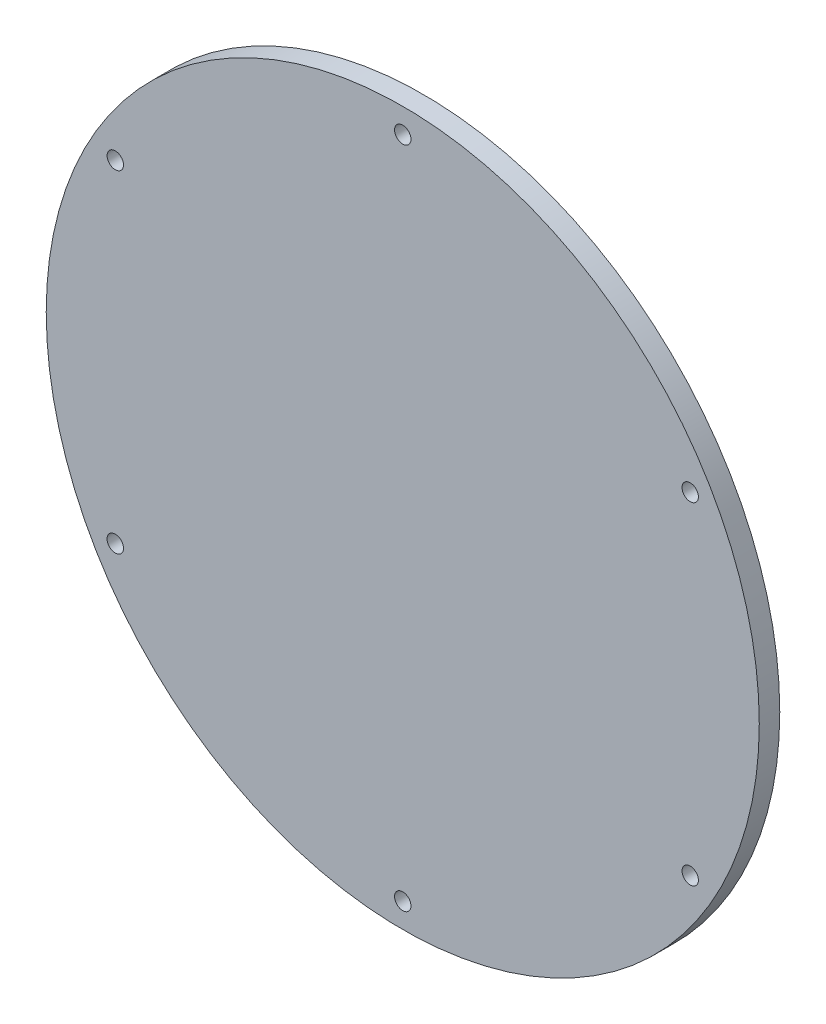
from build123d import *

# Parameters (mm, degrees)
SKETCH1_R           = 174
SKETCH1_R_2         = 4
BOSS_EXTRUDE1_DEPTH = 10


with BuildPart() as part:
    # Sketch1 → Boss-Extrude1 (new body)
    with BuildSketch(Plane.XY):
        Circle(SKETCH1_R)
        with Locations((0, 162)):
            Circle(SKETCH1_R_2, mode=Mode.SUBTRACT)
        with Locations((140.296115413, 81)):
            Circle(SKETCH1_R_2, mode=Mode.SUBTRACT)
        with Locations((140.296115413, -81)):
            Circle(SKETCH1_R_2, mode=Mode.SUBTRACT)
        with Locations((0, -162)):
            Circle(SKETCH1_R_2, mode=Mode.SUBTRACT)
        with Locations((-140.296115413, -81)):
            Circle(SKETCH1_R_2, mode=Mode.SUBTRACT)
        with Locations((-140.296115413, 81)):
            Circle(SKETCH1_R_2, mode=Mode.SUBTRACT)
    extrude(amount=BOSS_EXTRUDE1_DEPTH)


solid = part.part
